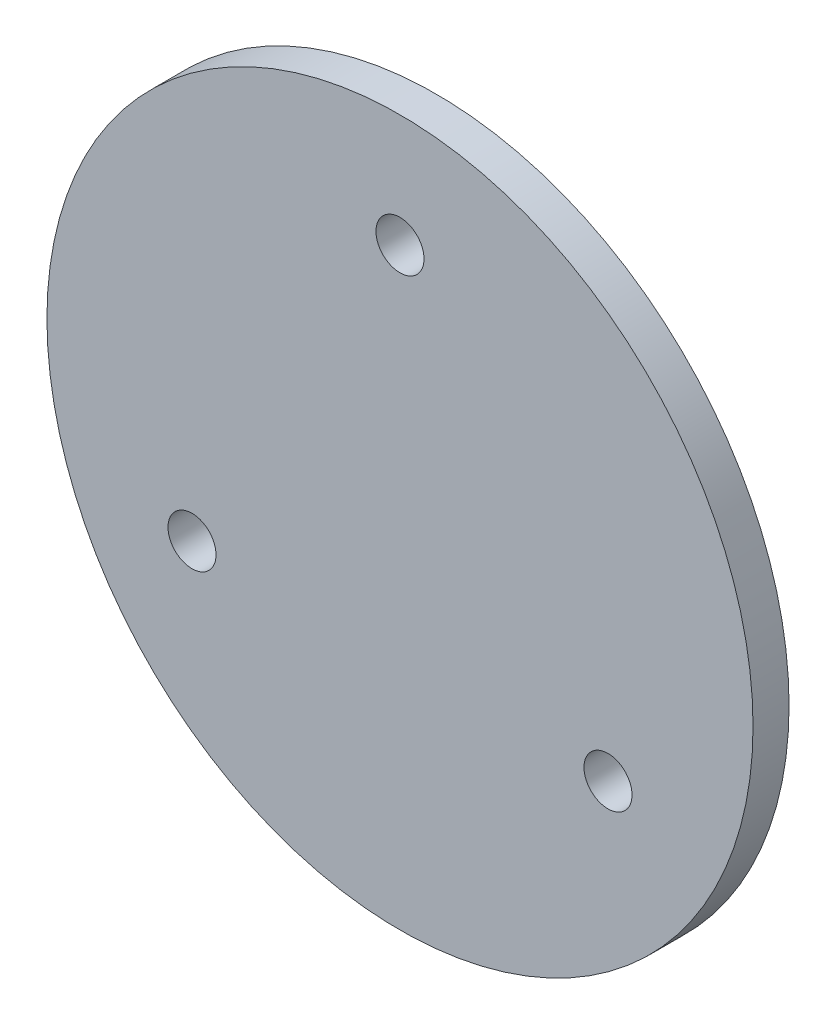
from build123d import *

# Parameters (mm, degrees)
SKETCH1_W           = 23
SKETCH1_H           = 22
BOSS_EXTRUDE1_DEPTH = 5
SKETCH3_R           = 29.4
BOSS_EXTRUDE2_DEPTH = 3
SKETCH4_R           = 2
CUT_EXTRUDE1_DEPTH  = 3


with BuildPart() as part:
    # Sketch1 → Boss-Extrude1 (new body)
    with BuildSketch(Plane.XY):
        Rectangle(SKETCH1_W, SKETCH1_H)
    extrude(amount=BOSS_EXTRUDE1_DEPTH)

    # Sketch3 → Boss-Extrude2 (add)
    with BuildSketch(Plane.XY.offset(5)):
        Circle(SKETCH3_R)
    extrude(amount=BOSS_EXTRUDE2_DEPTH)

    # Sketch4 → Cut-Extrude1 (cut)
    with BuildSketch(Plane.XY.offset(8)):
        with Locations((0, 20)):
            Circle(SKETCH4_R)
        with Locations((17.320508076, -10)):
            Circle(SKETCH4_R)
        with Locations((-17.320508076, -10)):
            Circle(SKETCH4_R)
    extrude(amount=-CUT_EXTRUDE1_DEPTH, mode=Mode.SUBTRACT)


solid = part.part
